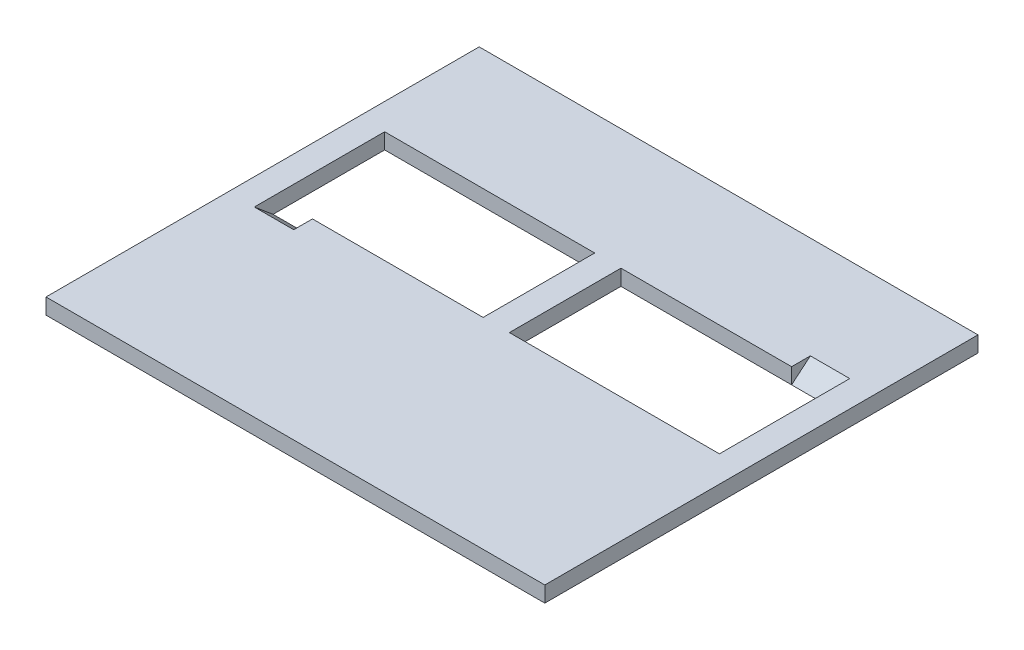
from build123d import *

# Parameters (mm, degrees)
SKETCH1_W           = 190
SKETCH1_H           = 165
SKETCH1_W_2         = 80
SKETCH1_H_2         = 42.5
BOSS_EXTRUDE1_DEPTH = 6
CUT_EXTRUDE1_DEPTH  = 15
CUT_EXTRUDE2_DEPTH  = 15


with BuildPart() as part:
    # Sketch1 → Boss-Extrude1 (new body)
    with BuildSketch(Plane(origin=(0, 0, 0), x_dir=(1, 0, 0), z_dir=(0, 1, 0))):
        Rectangle(SKETCH1_W, SKETCH1_H)
        with Locations((45, 15.25)):
            Rectangle(SKETCH1_W_2, SKETCH1_H_2, mode=Mode.SUBTRACT)
        with Locations((-45, 15.25)):
            Rectangle(SKETCH1_W_2, SKETCH1_H_2, mode=Mode.SUBTRACT)
    extrude(amount=BOSS_EXTRUDE1_DEPTH)

    # Sketch2 → Cut-Extrude1 (cut)
    with BuildSketch(Plane.ZY.offset(-85)):
        Polygon((-43.650521556, 6), (-36.5, 0), (-36.5, 6), align=None)
    extrude(amount=CUT_EXTRUDE1_DEPTH, mode=Mode.SUBTRACT)

    # Sketch3 → Cut-Extrude2 (cut)
    with BuildSketch(Plane(origin=(-85, 0, 0), x_dir=(0, 0, -1), z_dir=(1, 0, 0))):
        Polygon((-6, 0), (-13.150521556, 6), (-6, 6), align=None)
    extrude(amount=CUT_EXTRUDE2_DEPTH, mode=Mode.SUBTRACT)


solid = part.part
